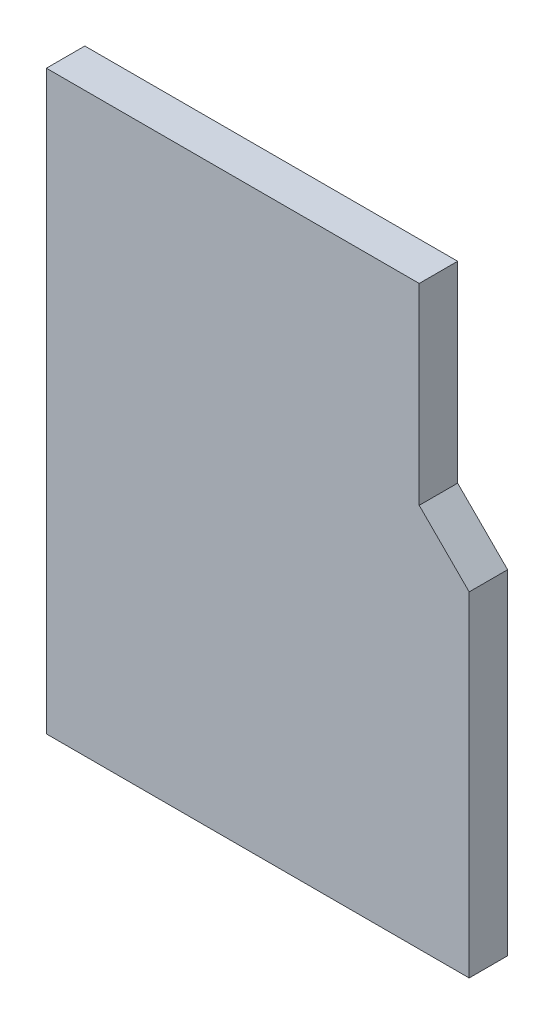
from build123d import *

# Parameters (mm, degrees)
SALIENTE_EXTRUIR1_DEPTH = 1


with BuildPart() as part:
    # Croquis1 → Saliente-Extruir1 (new body)
    with BuildSketch(Plane.XY):
        Polygon((0, 0), (0, 15), (9.7, 15), (9.7, 10), (11, 8.7), (11, 0), align=None)
    extrude(amount=SALIENTE_EXTRUIR1_DEPTH)


solid = part.part
